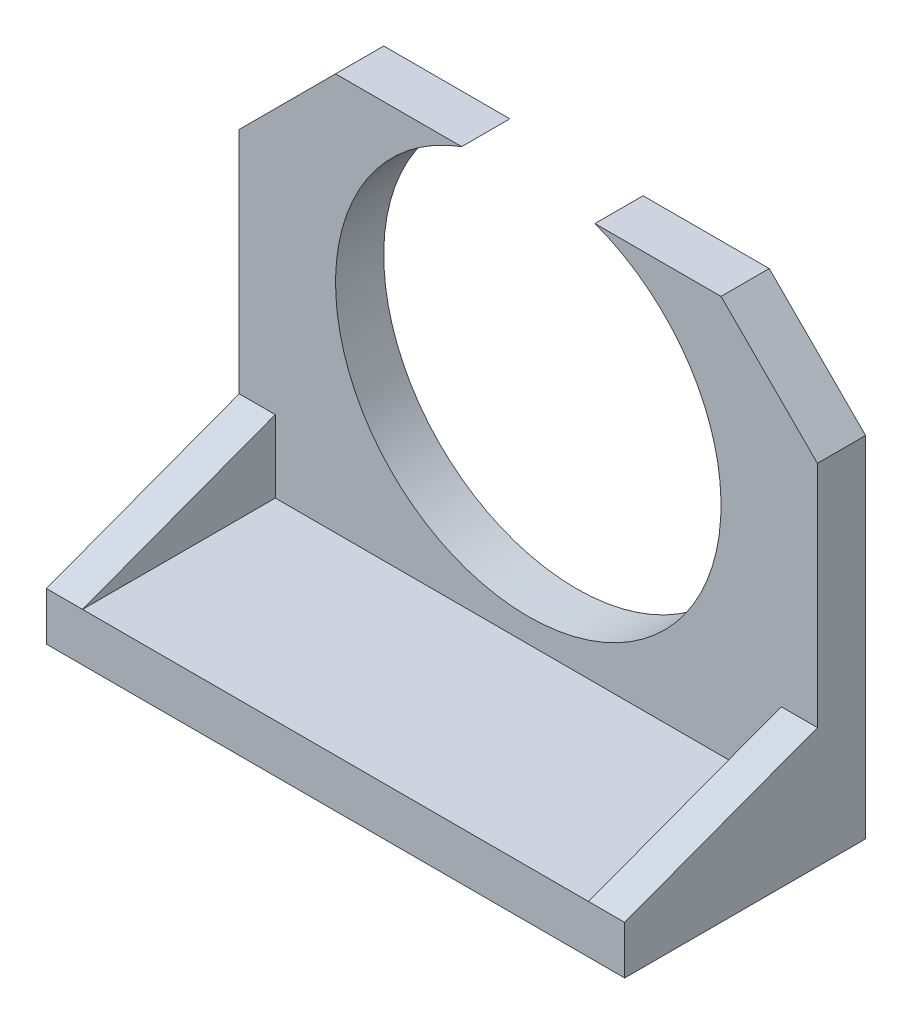
from build123d import *

# Parameters (mm, degrees)
SKETCH1_W           = 24
SKETCH1_H           = 10
BOSS_EXTRUDE1_DEPTH = 2
SKETCH2_W           = 24
SKETCH2_H           = 2
BOSS_EXTRUDE2_DEPTH = 16.5
SKETCH3_R           = 8
CUT_EXTRUDE1_DEPTH  = 2
CUT_EXTRUDE2_DEPTH  = 2
BOSS_EXTRUDE4_DEPTH = 1.5
BOSS_EXTRUDE5_DEPTH = 1.5


with BuildPart() as part:
    # Sketch1 → Boss-Extrude1 (new body)
    with BuildSketch(Plane(origin=(0, 0, 0), x_dir=(1, 0, 0), z_dir=(0, 1, 0))):
        Rectangle(SKETCH1_W, SKETCH1_H)
    extrude(amount=BOSS_EXTRUDE1_DEPTH)

    # Sketch2 → Boss-Extrude2 (add)
    with BuildSketch(Plane(origin=(0, 2, 0), x_dir=(1, 0, 0), z_dir=(0, 1, 0))):
        with Locations((0, 4)):
            Rectangle(SKETCH2_W, SKETCH2_H)
    extrude(amount=BOSS_EXTRUDE2_DEPTH)

    # Sketch3 → Cut-Extrude1 (cut)
    with BuildSketch(Plane.XY.offset(-3)):
        with Locations((0, 10.992781272)):
            Circle(SKETCH3_R)
    extrude(amount=-CUT_EXTRUDE1_DEPTH, mode=Mode.SUBTRACT)

    # Sketch6 → Cut-Extrude2 (cut)
    with BuildSketch(Plane.XY.offset(-3)):
        Polygon((-12, 18.5), (-8, 18.5), (-12, 14.5), align=None)
        Polygon((12, 18.5), (8, 18.5), (12, 14.5), align=None)
    extrude(amount=-CUT_EXTRUDE2_DEPTH, mode=Mode.SUBTRACT)

    # Sketch7 → Boss-Extrude4 (add)
    with BuildSketch(Plane.ZY.offset(12)):
        Polygon((-3, 2), (-3, 5), (5, 2), align=None)
    extrude(amount=-BOSS_EXTRUDE4_DEPTH)

    # Sketch8 → Boss-Extrude5 (add)
    with BuildSketch(Plane(origin=(12, 0, 0), x_dir=(0, 0, -1), z_dir=(1, 0, 0))):
        Polygon((-5, 2), (3, 2), (3, 5), align=None)
    extrude(amount=-BOSS_EXTRUDE5_DEPTH)


solid = part.part
